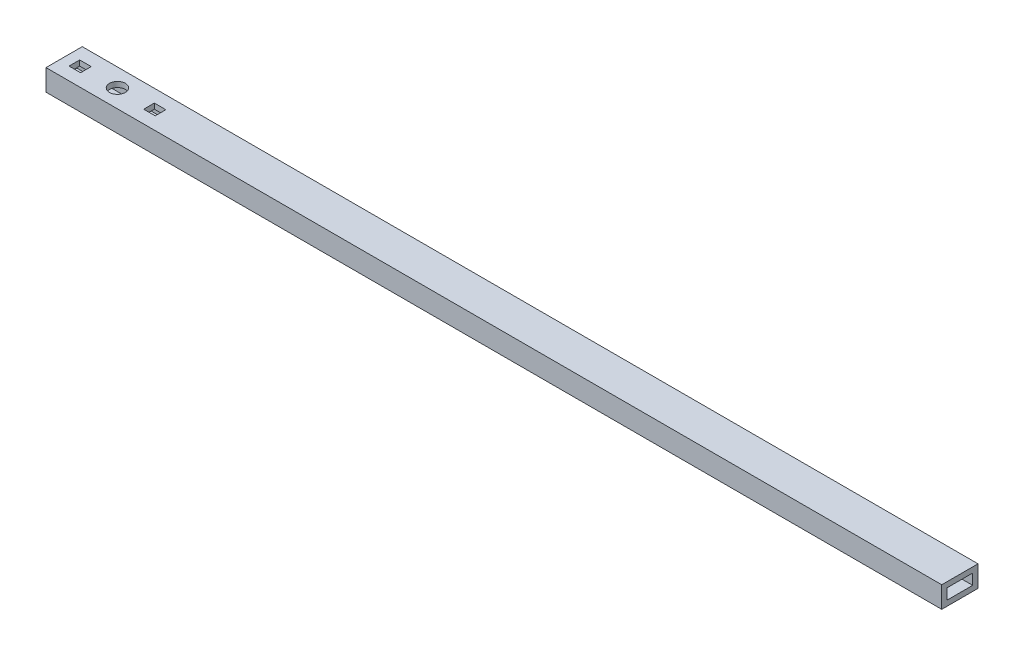
from build123d import *

# Parameters (mm, degrees)
ESQUISSE1_W             = 21.59
ESQUISSE1_H             = 12.7
ESQUISSE1_W_2           = 15.24
ESQUISSE1_H_2           = 6.35
BOSS_EXTRU_1_DEPTH      = 596.9
ESQUISSE2_R             = 4.7244
ESQUISSE2_W             = 6.858
ESQUISSE2_H             = 6.35
ENL_V_MAT_EXTRU_1_DEPTH = 598.132675396
ESQUISSE3_W             = 63.5
ESQUISSE3_H             = 21.59
ENL_V_MAT_EXTRU_2_DEPTH = 598.132675396


with BuildPart() as part:
    # Esquisse1 → Boss.-Extru.1 (new body)
    with BuildSketch(Plane(origin=(0, 0, 0), x_dir=(0, 0, -1), z_dir=(1, 0, 0))):
        Rectangle(ESQUISSE1_W, ESQUISSE1_H)
        Rectangle(ESQUISSE1_W_2, ESQUISSE1_H_2, mode=Mode.SUBTRACT)
    extrude(amount=BOSS_EXTRU_1_DEPTH)

    # Esquisse2 → Enlèv. mat.-Extru.1 (cut, through all)
    with BuildSketch(Plane.XZ.offset(6.35)):
        with Locations(Location((31.75, 0, 0), (0, 0, 270))):
            Circle(ESQUISSE2_R)
        with Locations((9.525, 0)):
            Rectangle(ESQUISSE2_W, ESQUISSE2_H)
        with Locations((53.975, 0)):
            Rectangle(ESQUISSE2_W, ESQUISSE2_H)
    enl_v_mat_extru_1 = extrude(amount=-ENL_V_MAT_EXTRU_1_DEPTH, mode=Mode.SUBTRACT)

    # Symétrie1: Enlèv. mat.-Extru.1 across plane
    add(enl_v_mat_extru_1.mirror(Plane.ZY.offset(-298.45)), mode=Mode.SUBTRACT)

    # Esquisse3 → Enlèv. mat.-Extru.2 (cut, through all)
    with BuildSketch(Plane.XZ.offset(6.35)):
        with Locations((565.15, 0)):
            Rectangle(ESQUISSE3_W, ESQUISSE3_H)
    extrude(amount=-ENL_V_MAT_EXTRU_2_DEPTH, mode=Mode.SUBTRACT)


solid = part.part
